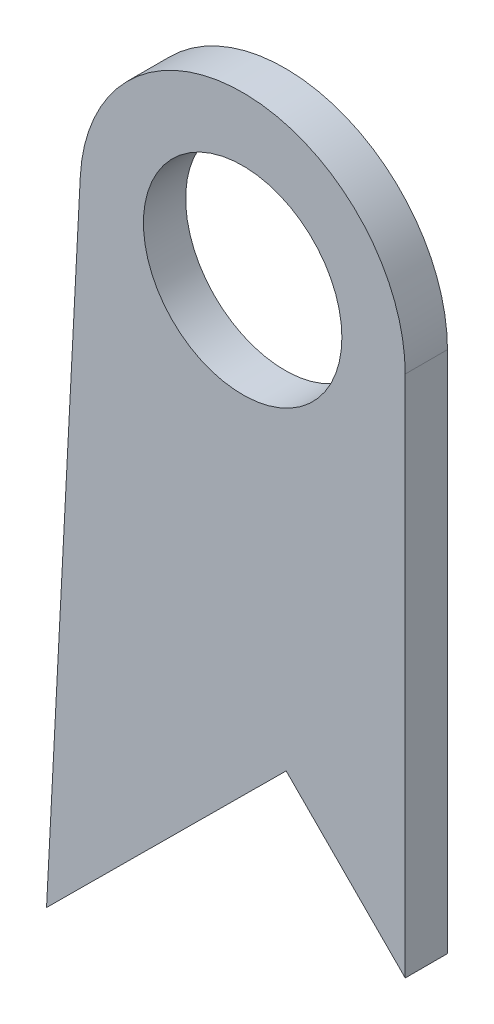
from build123d import *

# Parameters (mm, degrees)
ESQUISSE1_R        = 23.5
BOSS_EXTRU_1_DEPTH = 10


with BuildPart() as part:
    # Esquisse1 → Boss.-Extru.1 (new body)
    with BuildSketch(Plane.XY):
        with BuildLine():
            Line((38.5, 0), (38.5, -123.865854859))
            Line((38.5, -123.865854859), (10.305167806, -95.492426488))
            Line((10.305167806, -95.492426488), (-46.441688937, -151.882090875))
            Line((-46.441688937, -151.882090875), (-38.448159478, 1.997256299))
            ThreePointArc((-38.448159478, 1.997256299), (0.998964484, 38.487037688), (38.5, 0))
        make_face()
        Circle(ESQUISSE1_R, mode=Mode.SUBTRACT)
    extrude(amount=BOSS_EXTRU_1_DEPTH)


solid = part.part
